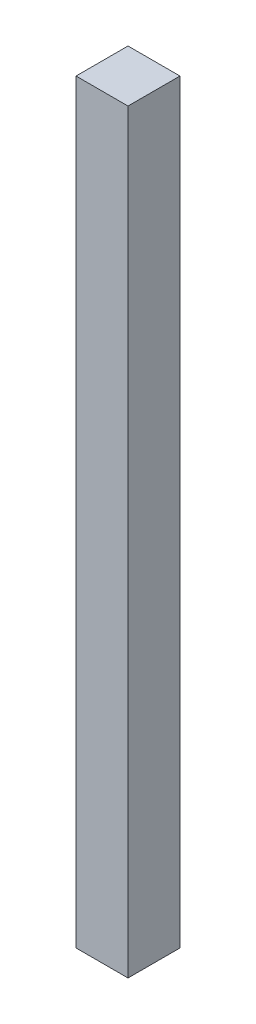
from build123d import *

# Parameters (mm, degrees)
SKETCH1_W           = 20
SKETCH1_H           = 20
BOSS_EXTRUDE1_DEPTH = 290.560450608


with BuildPart() as part:
    # Sketch1 → Boss-Extrude1 (new body)
    with BuildSketch(Plane(origin=(0, 0, 0), x_dir=(1, 0, 0), z_dir=(0, 1, 0))):
        with Locations((10, -10)):
            Rectangle(SKETCH1_W, SKETCH1_H)
    extrude(amount=BOSS_EXTRUDE1_DEPTH)


solid = part.part
